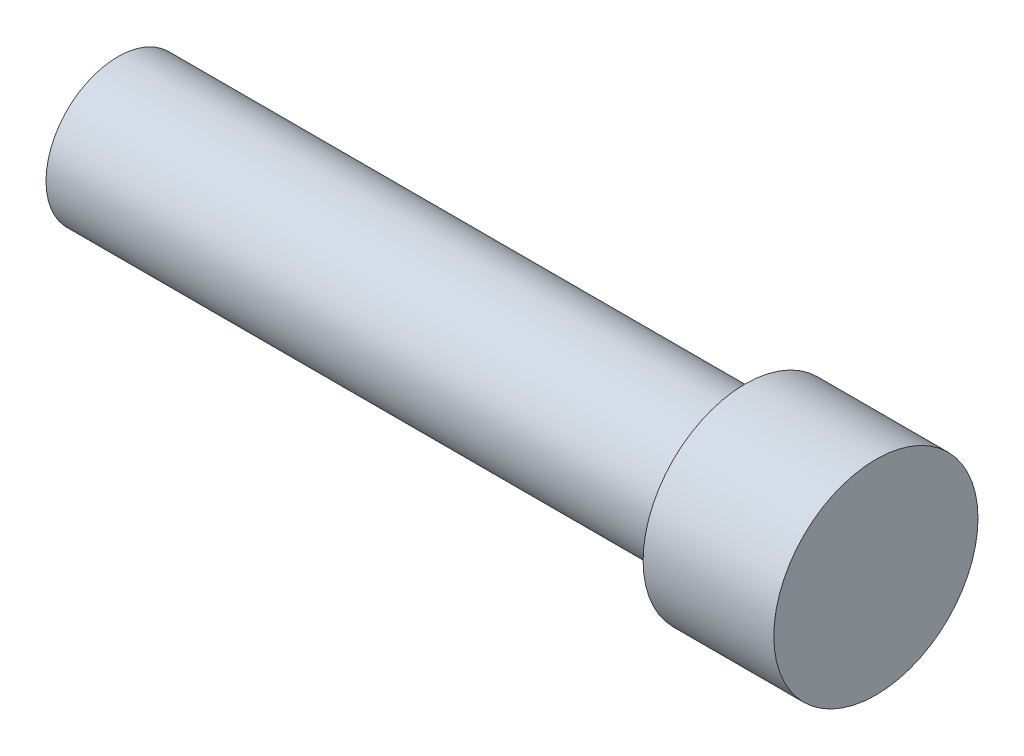
from build123d import *

# Parameters (mm, degrees)
SKETCH1_R           = 5.953125
BOSS_EXTRUDE1_DEPTH = 7.62
SKETCH2_R           = 4.191
BOSS_EXTRUDE2_DEPTH = 36.576


with BuildPart() as part:
    # Sketch1 → Boss-Extrude1 (new body)
    with BuildSketch(Plane(origin=(0, 0, 0), x_dir=(0, 0, -1), z_dir=(1, 0, 0))):
        with Locations(Location((0, 0, 0), (0, 0, 180))):
            Circle(SKETCH1_R)
    extrude(amount=BOSS_EXTRUDE1_DEPTH)

    # Sketch2 → Boss-Extrude2 (add)
    with BuildSketch(Plane.ZY):
        Circle(SKETCH2_R)
    extrude(amount=BOSS_EXTRUDE2_DEPTH)


solid = part.part
